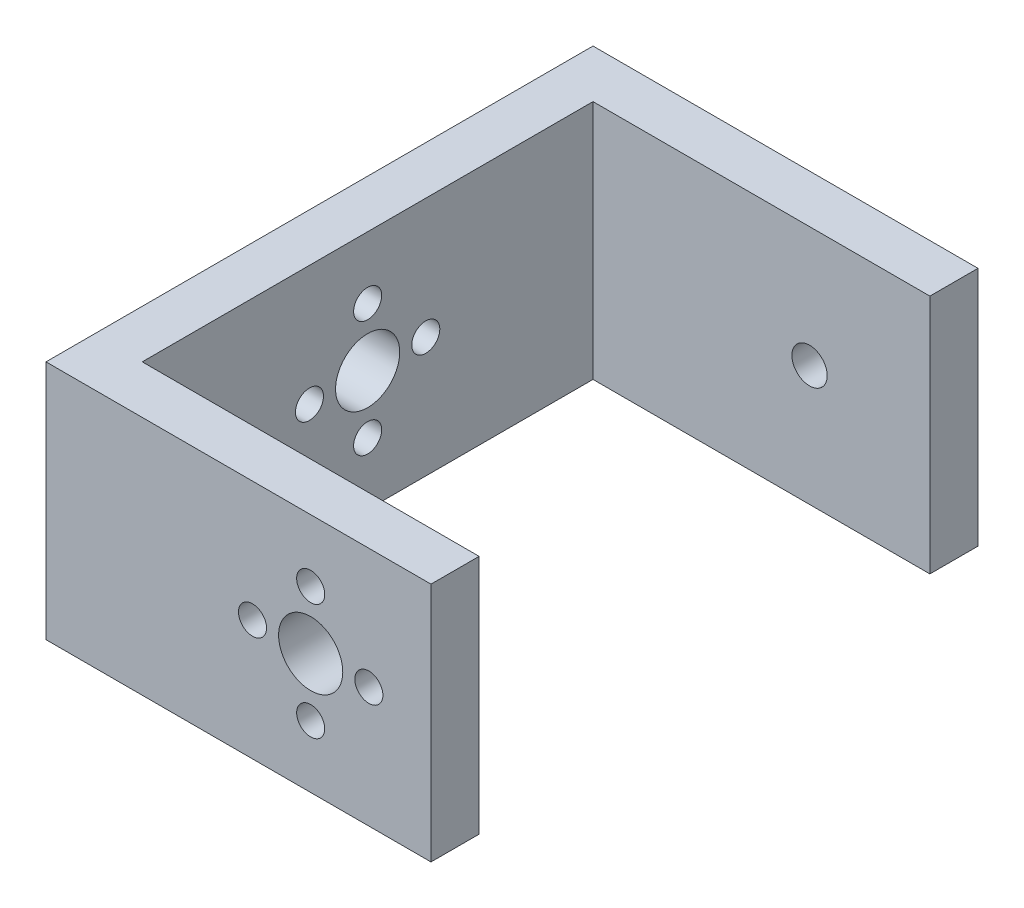
from build123d import *

# Parameters (mm, degrees)
BOSS_EXTRUDE1_DEPTH            = 30
CUT_EXTRUDE1_REACH             = 63.861
SKETCH2_R                      = 4
SKETCH2_R_2                    = 1.75
CUT_EXTRUDE2_REACH             = 81.248
SKETCH3_R                      = 4
CUT_EXTRUDE3_REACH             = 81.248
SKETCH4_R                      = 1.75
CUT_EXTRUDE4_REACH             = 81.248
SKETCH5_R                      = 2.2
CUT_EXTRUDE4_DIRECTION_2_DEPTH = 80.247965274


with BuildPart() as part:
    # Sketch1 → Boss-Extrude1 (new body)
    with BuildSketch(Plane(origin=(0, 0, 0), x_dir=(1, 0, 0), z_dir=(0, 1, 0))):
        Polygon((21, -28.1), (21, -34.1), (-27, -34.1), (-27, 34.1), (21, 34.1), (21, 28.1), (-21, 28.1), (-21, -28.1), align=None)
    extrude(amount=BOSS_EXTRUDE1_DEPTH)

    # Sketch2 → Cut-Extrude1 (cut, up to next)
    with BuildSketch(Plane(origin=(-21, 0, 0), x_dir=(0, 0, -1), z_dir=(1, 0, 0)), mode=Mode.PRIVATE) as cut_extrude1_sk1:
        with Locations((0, 15)):
            Circle(SKETCH2_R)
    cut_extrude1_tool1 = extrude(cut_extrude1_sk1.sketch, amount=-CUT_EXTRUDE1_REACH, mode=Mode.PRIVATE) & part.part
    # Sketch2 → Cut-Extrude1 (cut, up to next)
    with BuildSketch(Plane(origin=(-21, 0, 0), x_dir=(0, 0, -1), z_dir=(1, 0, 0)), mode=Mode.PRIVATE) as cut_extrude1_sk2:
        with Locations((0, 22.25)):
            Circle(SKETCH2_R_2)
    cut_extrude1_tool2 = extrude(cut_extrude1_sk2.sketch, amount=-CUT_EXTRUDE1_REACH, mode=Mode.PRIVATE) & part.part
    # Sketch2 → Cut-Extrude1 (cut, up to next)
    with BuildSketch(Plane(origin=(-21, 0, 0), x_dir=(0, 0, -1), z_dir=(1, 0, 0)), mode=Mode.PRIVATE) as cut_extrude1_sk3:
        with Locations((7.25, 15)):
            Circle(SKETCH2_R_2)
    cut_extrude1_tool3 = extrude(cut_extrude1_sk3.sketch, amount=-CUT_EXTRUDE1_REACH, mode=Mode.PRIVATE) & part.part
    # Sketch2 → Cut-Extrude1 (cut, up to next)
    with BuildSketch(Plane(origin=(-21, 0, 0), x_dir=(0, 0, -1), z_dir=(1, 0, 0)), mode=Mode.PRIVATE) as cut_extrude1_sk4:
        with Locations((0, 7.75)):
            Circle(SKETCH2_R_2)
    cut_extrude1_tool4 = extrude(cut_extrude1_sk4.sketch, amount=-CUT_EXTRUDE1_REACH, mode=Mode.PRIVATE) & part.part
    # Sketch2 → Cut-Extrude1 (cut, up to next)
    with BuildSketch(Plane(origin=(-21, 0, 0), x_dir=(0, 0, -1), z_dir=(1, 0, 0)), mode=Mode.PRIVATE) as cut_extrude1_sk5:
        with Locations((-7.25, 15)):
            Circle(SKETCH2_R_2)
    cut_extrude1_tool5 = extrude(cut_extrude1_sk5.sketch, amount=-CUT_EXTRUDE1_REACH, mode=Mode.PRIVATE) & part.part
    add(cut_extrude1_tool1.solids().sort_by_distance((-21, 15, 0))[0], mode=Mode.SUBTRACT)
    add(cut_extrude1_tool2.solids().sort_by_distance((-21, 22.25, 0))[0], mode=Mode.SUBTRACT)
    add(cut_extrude1_tool3.solids().sort_by_distance((-21, 15, -7.25))[0], mode=Mode.SUBTRACT)
    add(cut_extrude1_tool4.solids().sort_by_distance((-21, 7.75, 0))[0], mode=Mode.SUBTRACT)
    add(cut_extrude1_tool5.solids().sort_by_distance((-21, 15, 7.25))[0], mode=Mode.SUBTRACT)

    # Sketch3 → Cut-Extrude2 (cut, up to next)
    with BuildSketch(Plane.XY.offset(34.1), mode=Mode.PRIVATE) as cut_extrude2_sk1:
        with Locations((6, 15)):
            Circle(SKETCH3_R)
    cut_extrude2_tool1 = extrude(cut_extrude2_sk1.sketch, amount=-CUT_EXTRUDE2_REACH, mode=Mode.PRIVATE) & part.part
    add(cut_extrude2_tool1.solids().sort_by_distance((6, 15, 34.1))[0], mode=Mode.SUBTRACT)

    # Sketch4 → Cut-Extrude3 (cut, up to next)
    with BuildSketch(Plane.XY.offset(34.1), mode=Mode.PRIVATE) as cut_extrude3_sk1:
        with Locations((6, 22.25)):
            Circle(SKETCH4_R)
    cut_extrude3_tool1 = extrude(cut_extrude3_sk1.sketch, amount=-CUT_EXTRUDE3_REACH, mode=Mode.PRIVATE) & part.part
    # Sketch4 → Cut-Extrude3 (cut, up to next)
    with BuildSketch(Plane.XY.offset(34.1), mode=Mode.PRIVATE) as cut_extrude3_sk2:
        with Locations((13.25, 15)):
            Circle(SKETCH4_R)
    cut_extrude3_tool2 = extrude(cut_extrude3_sk2.sketch, amount=-CUT_EXTRUDE3_REACH, mode=Mode.PRIVATE) & part.part
    # Sketch4 → Cut-Extrude3 (cut, up to next)
    with BuildSketch(Plane.XY.offset(34.1), mode=Mode.PRIVATE) as cut_extrude3_sk3:
        with Locations((6, 7.75)):
            Circle(SKETCH4_R)
    cut_extrude3_tool3 = extrude(cut_extrude3_sk3.sketch, amount=-CUT_EXTRUDE3_REACH, mode=Mode.PRIVATE) & part.part
    # Sketch4 → Cut-Extrude3 (cut, up to next)
    with BuildSketch(Plane.XY.offset(34.1), mode=Mode.PRIVATE) as cut_extrude3_sk4:
        with Locations((-1.25, 15)):
            Circle(SKETCH4_R)
    cut_extrude3_tool4 = extrude(cut_extrude3_sk4.sketch, amount=-CUT_EXTRUDE3_REACH, mode=Mode.PRIVATE) & part.part
    add(cut_extrude3_tool1.solids().sort_by_distance((6, 22.25, 34.1))[0], mode=Mode.SUBTRACT)
    add(cut_extrude3_tool2.solids().sort_by_distance((13.25, 15, 34.1))[0], mode=Mode.SUBTRACT)
    add(cut_extrude3_tool3.solids().sort_by_distance((6, 7.75, 34.1))[0], mode=Mode.SUBTRACT)
    add(cut_extrude3_tool4.solids().sort_by_distance((-1.25, 15, 34.1))[0], mode=Mode.SUBTRACT)

    # Sketch5 → Cut-Extrude4 (cut, up to next)
    with BuildSketch(Plane(origin=(0, 0, -34.1), x_dir=(-1, 0, 0), z_dir=(0, 0, -1)), mode=Mode.PRIVATE) as cut_extrude4_sk1:
        with Locations(Location((-6, 15, 0), (0, 0, 180))):
            Circle(SKETCH5_R)
    cut_extrude4_tool1 = extrude(cut_extrude4_sk1.sketch, amount=-CUT_EXTRUDE4_REACH, mode=Mode.PRIVATE) & part.part
    add(cut_extrude4_tool1.solids().sort_by_distance((6, 15, -34.1))[0], mode=Mode.SUBTRACT)

    # Sketch5 → Cut-Extrude4 direction 2 (cut)
    with BuildSketch(Plane(origin=(0, 0, -34.1), x_dir=(-1, 0, 0), z_dir=(0, 0, -1))):
        with Locations(Location((-6, 15, 0), (0, 0, 180))):
            Circle(SKETCH5_R)
    extrude(amount=CUT_EXTRUDE4_DIRECTION_2_DEPTH, mode=Mode.SUBTRACT)


solid = part.part
